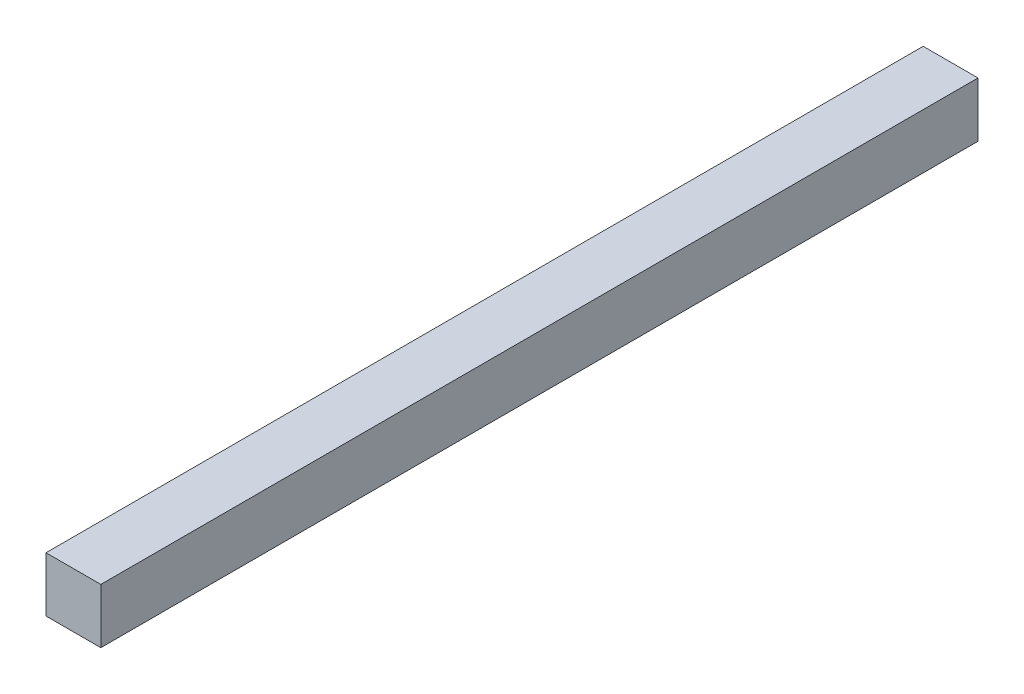
from build123d import *

# Parameters (mm, degrees)
SKETCH1_W           = 19.05
SKETCH1_H           = 19.05
BOSS_EXTRUDE1_DEPTH = 152.4


with BuildPart() as part:
    # Sketch1 → Boss-Extrude1 (new, symmetric)
    with BuildSketch(Plane.XY):
        Rectangle(SKETCH1_W, SKETCH1_H)
    extrude(amount=BOSS_EXTRUDE1_DEPTH, both=True)


solid = part.part
